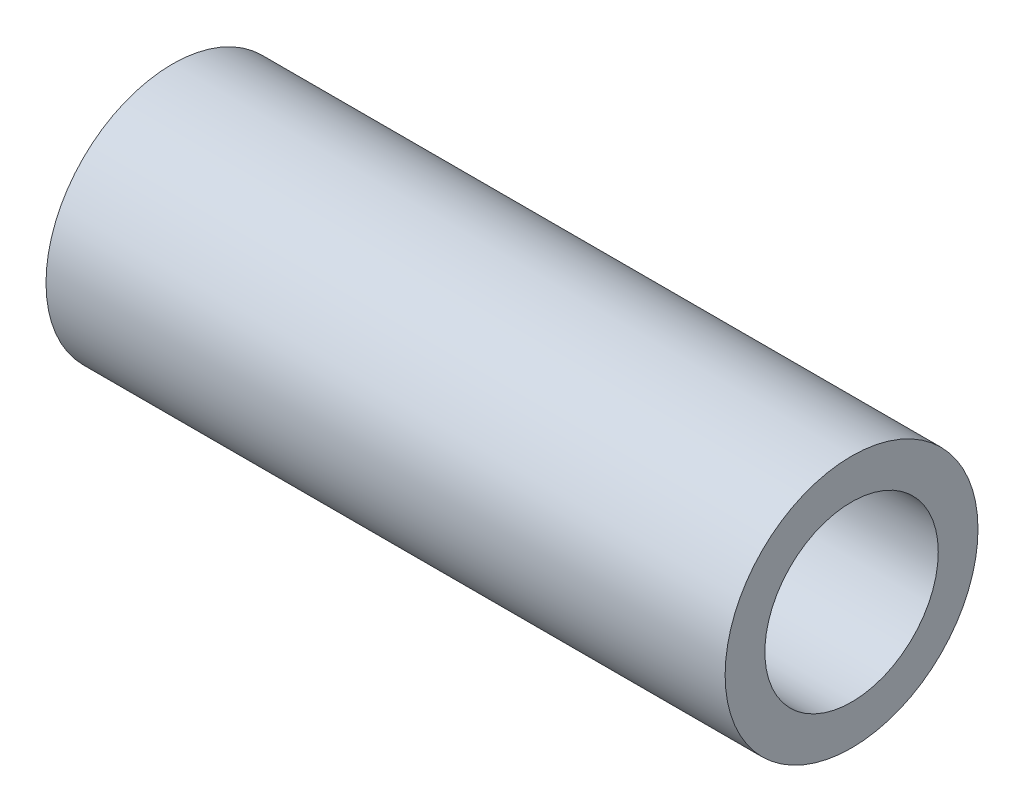
from build123d import *

# Parameters (mm, degrees)
SKETCH1_R           = 4.445
SKETCH1_R_2         = 3.048
BOSS_EXTRUDE1_DEPTH = 23.876


with BuildPart() as part:
    # Sketch1 → Boss-Extrude1 (new body)
    with BuildSketch(Plane(origin=(0, 0, 0), x_dir=(0, 0, -1), z_dir=(1, 0, 0))):
        Circle(SKETCH1_R)
        Circle(SKETCH1_R_2, mode=Mode.SUBTRACT)
    extrude(amount=BOSS_EXTRUDE1_DEPTH)


solid = part.part
